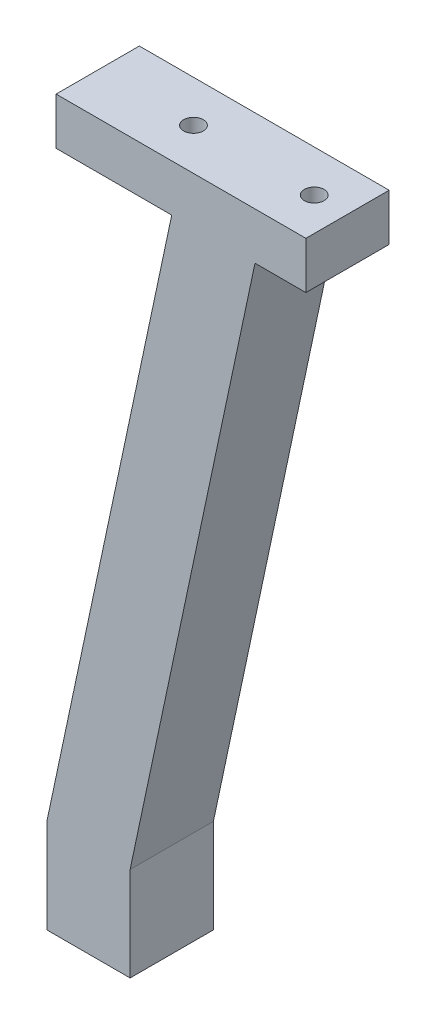
from build123d import *

# Parameters (mm, degrees)
SKETCH1_W           = 18
SKETCH1_H           = 18
SKETCH3_W           = 54
SKETCH3_H           = 18
BOSS_EXTRUDE1_DEPTH = 10.16
SKETCH4_W           = 8
SKETCH4_H           = 8
SKETCH6_R           = 2.125
CUT_EXTRUDE1_DEPTH  = 136.095622661
SKETCH7_R           = 3.3
CUT_EXTRUDE2_DEPTH  = 3
SKETCH8_W           = 4
SKETCH8_H           = 20
CUT_EXTRUDE3_DEPTH  = 2
SKETCH9_W           = 18
SKETCH9_H           = 18
BOSS_EXTRUDE2_DEPTH = 20.32
SKETCH10_R          = 1.6764
CUT_EXTRUDE4_DEPTH  = 15.24


with BuildPart() as part:
    # Sweep1: sweep along a path in Sketch2
    with BuildLine(Plane.XY) as sweep1_path:
        Line((-10.900401277, 0), (16.094282055, 127))
    # Sketch1 → Sweep1 (sweep)
    with BuildSketch(Plane(origin=(0, 0, 0), x_dir=(1, 0, 0), z_dir=(0, 1, 0))):
        with Locations((-1.900401277, 0.398563086)):
            Rectangle(SKETCH1_W, SKETCH1_H)
    sweep(path=sweep1_path.line)

    # Sketch3 → Boss-Extrude1 (add)
    with BuildSketch(Plane(origin=(0, 127, 0), x_dir=(1, 0, 0), z_dir=(0, 1, 0))):
        with Locations((18.094282055, 0.398563086)):
            Rectangle(SKETCH3_W, SKETCH3_H)
    extrude(amount=BOSS_EXTRUDE1_DEPTH)

    # Cut-Sweep1: sweep along a path in Sketch5
    with BuildLine(Plane.XY.offset(8.601436914)) as cut_sweep1_path:
        Line((-5.900401277, 0), (9.942469563, 74.534847176))
    # Sketch4 → Cut-Sweep1 (sweep, cut)
    with BuildSketch(Plane.XZ):
        with Locations((-1.900401277, -0.398563086)):
            Rectangle(SKETCH4_W, SKETCH4_H)
    sweep(path=cut_sweep1_path.line, mode=Mode.SUBTRACT)

    # Sketch6 → Cut-Extrude1 (cut, through all)
    with BuildSketch(Plane.XZ.offset(-127)):
        with Locations(Location((37.894282055, -0.398563086, 0), (0, 0, 270))):
            Circle(SKETCH6_R)
        with Locations(Location((11.794282055, -0.398563086, 0), (0, 0, 270))):
            Circle(SKETCH6_R)
    extrude(amount=-CUT_EXTRUDE1_DEPTH, mode=Mode.SUBTRACT)

    # Sketch7 → Cut-Extrude2 (cut)
    with BuildSketch(Plane.XZ.offset(-127)):
        with Locations(Location((11.794282055, -0.398563086, 0), (0, 0, 270))):
            Circle(SKETCH7_R)
        with Locations(Location((37.894282055, -0.398563086, 0), (0, 0, 270))):
            Circle(SKETCH7_R)
    extrude(amount=-CUT_EXTRUDE2_DEPTH, mode=Mode.SUBTRACT)

    # Sketch8 → Cut-Extrude3 (cut)
    with BuildSketch(Plane(origin=(-10.429206675, 2.216796312, 0), x_dir=(0, 0, 1), z_dir=(-0.9781476007338064, 0.20791169081775596, 0))):
        with Locations((-0.398563086, 117.570934688)):
            Rectangle(SKETCH8_W, SKETCH8_H)
    extrude(amount=-CUT_EXTRUDE3_DEPTH, mode=Mode.SUBTRACT)

    # Sketch9 → Boss-Extrude2 (add)
    with BuildSketch(Plane.XZ):
        with Locations((-1.900401277, -0.398563086)):
            Rectangle(SKETCH9_W, SKETCH9_H)
    extrude(amount=BOSS_EXTRUDE2_DEPTH)

    # Sketch10 → Cut-Extrude4 (cut)
    with BuildSketch(Plane.XZ.offset(20.32)):
        with Locations(Location((-1.900401277, -0.398563086, 0), (0, 0, 270))):
            Circle(SKETCH10_R)
    extrude(amount=-CUT_EXTRUDE4_DEPTH, mode=Mode.SUBTRACT)


solid = part.part
